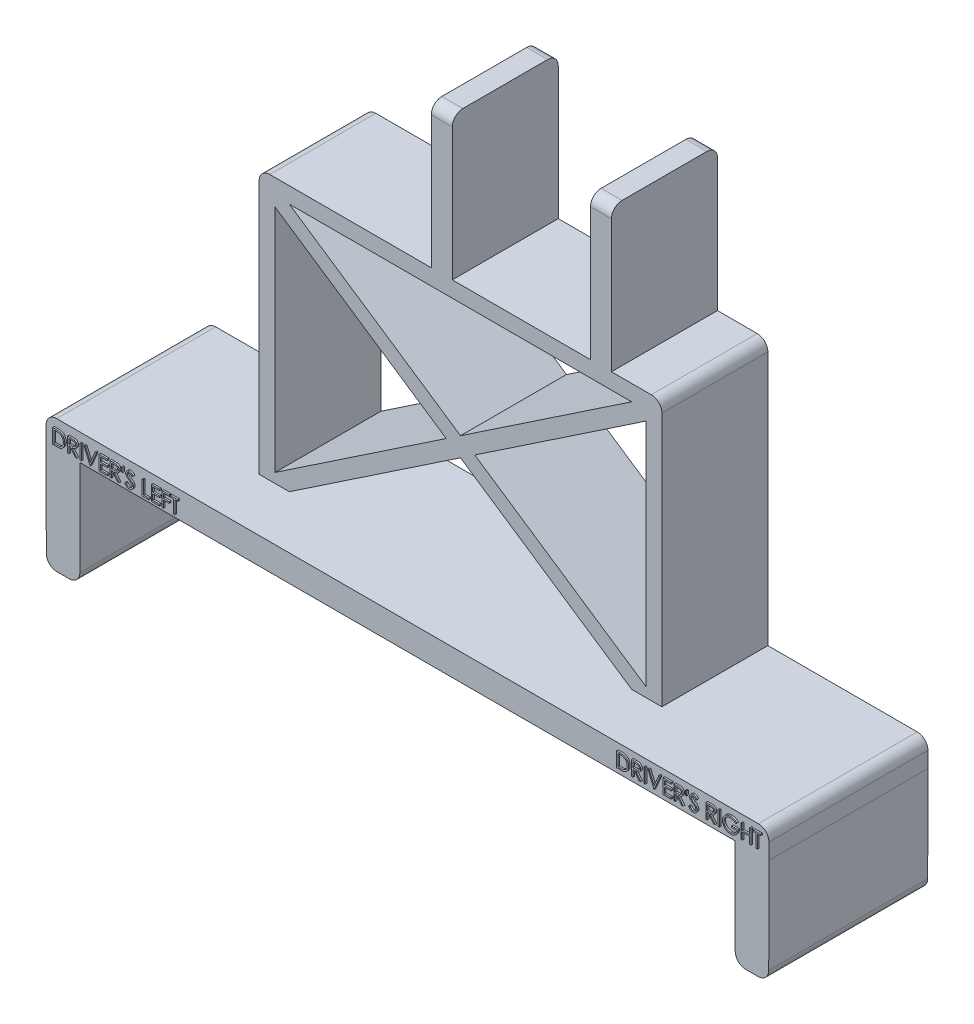
from build123d import *

# Parameters (mm, degrees)
BOSS_EXTRUDE2_DEPTH  = 38.1
BOSS_EXTRUDE6_DEPTH  = 25.4
SKETCH6_W            = 5.08
SKETCH6_H            = 25.4
BOSS_EXTRUDE5_DEPTH  = 34.29
FILLET1_R            = 2.54
BOSS_EXTRUDE7_DEPTH  = 25.4
CLEARANCE_START      = -38.1
SKETCH3_W            = 0.0508
SKETCH3_H            = 34.29
CLEARANCE_TRIM_DEPTH = 38.1
FILLET2_R            = 2.54
SKETCH12_W           = 0.314102565
SKETCH12_H           = 3.5
SKETCH12_W_2         = 0.314102564
TEXT_2_DEPTH         = 0.4


with BuildPart() as part:
    # Sketch1 → Boss-Extrude2 (new body)
    with BuildSketch(Plane.XY):
        Polygon((8.128, 0), (8.128, 25.4), (165.1, 25.4), (165.1, 0), (173.228, 0), (173.228, 31.75), (0, 31.75), (0, 0), align=None)
    extrude(amount=BOSS_EXTRUDE2_DEPTH)

    # Sketch7 → Boss-Extrude6 (add)
    with BuildSketch(Plane.XY):
        Polygon((38.354, 95.25), (38.354, 31.75), (42.164, 31.75), (42.164, 91.44), (131.064, 91.44), (131.064, 31.75), (134.874, 31.75), (134.874, 95.25), align=None)
    extrude(amount=BOSS_EXTRUDE6_DEPTH)

    # Sketch6 → Boss-Extrude5 (add)
    with BuildSketch(Plane(origin=(0, 95.25, 0), x_dir=(1, 0, 0), z_dir=(0, 1, 0))):
        with Locations((82.15122, -12.7)):
            Rectangle(SKETCH6_W, SKETCH6_H)
        with Locations((120.25122, -12.7)):
            Rectangle(SKETCH6_W, SKETCH6_H)
    extrude(amount=BOSS_EXTRUDE5_DEPTH)

    # Fillet1
    fillet1_edges = [part.edges().sort_by_distance(p)[0] for p in [
        (0, 31.75, 19.05),
        (173.228, 31.75, 19.05),
        (134.874, 95.25, 12.7),
        (38.354, 95.25, 12.7),
        (82.15122, 129.54, 0),
        (82.15122, 129.54, 25.4),
        (120.25122, 129.54, 0),
        (120.25122, 129.54, 25.4),
    ]]
    fillet(fillet1_edges, radius=FILLET1_R)

    # Sketch11 → Boss-Extrude7 (add)
    with BuildSketch(Plane.XY):
        Polygon((42.164, 89.145430603), (83.196556217, 61.595), (42.164, 34.044569397), (42.164, 31.75), (45.581443783, 31.75), (86.614, 59.300430603), (127.646556217, 31.75), (131.064, 31.75), (131.064, 34.044569397), (90.031443783, 61.595), (131.064, 89.145430603), (131.064, 91.44), (127.646556217, 91.44), (86.614, 63.889569397), (45.581443783, 91.44), (42.164, 91.44), align=None)
    extrude(amount=BOSS_EXTRUDE7_DEPTH)

    # Sketch3 → Clearance Trim (cut)
    with BuildSketch(Plane.XY.offset(38.1).offset(CLEARANCE_START)):
        with Locations((84.66582, 112.395)):
            Rectangle(SKETCH3_W, SKETCH3_H)
        with Locations((117.73662, 112.395)):
            Rectangle(SKETCH3_W, SKETCH3_H)
        Polygon((0, 25.4), (0.0508, 0), (0, 0), align=None)
        Polygon((8.128, 25.4), (8.0772, 0), (8.128, 0), align=None)
        Polygon((165.1, 0), (165.1, 25.4), (165.1508, 0), align=None)
        Polygon((173.228, 25.4), (173.1772, 0), (173.228, 0), align=None)
    extrude(amount=CLEARANCE_TRIM_DEPTH, mode=Mode.SUBTRACT)

    # Fillet2
    fillet2_edges = [part.edges().sort_by_distance(p)[0] for p in [
        (0.0508, 0, 19.05),
        (165.1508, 0, 19.05),
        (8.0772, 0, 19.05),
        (173.1772, 0, 19.05),
    ]]
    fillet(fillet2_edges, radius=FILLET2_R)

    # Sketch12 → Text 2 (add)
    # profile 1 of 25: a face of its own
    with BuildSketch(Plane.XY.offset(38.1)):
        with BuildLine():
            Line((137.105766894, 26.785075079), (137.105766894, 30.285075079))
            Line((137.105766894, 30.285075079), (137.812497663, 30.285075079))
            add(Edge.make_bspline(
                [(137.812497663, 30.285075079), (137.873966652, 30.284632509), (137.992724417, 30.283777466), (138.164336864, 30.278356075), (138.323120627, 30.268765609), (138.468553486, 30.254796083), (138.601034698, 30.23764305), (138.720193306, 30.216142645), (138.826645449, 30.190754475), (138.892114889, 30.169109025), (138.923074586, 30.158873156)],
                knots=[0, 0, 0, 0, 1.314313732, 2.53924729, 3.670748893, 4.714932338, 5.66265055, 6.526160246, 7.303039223, 8, 8, 8, 8], degree=3))
            add(Edge.make_bspline(
                [(138.923074586, 30.158873156), (138.963569326, 30.143442451), (139.043640518, 30.112930957), (139.157647641, 30.055374655), (139.264973004, 29.990161553), (139.366192148, 29.917205691), (139.458992975, 29.834441342), (139.547000872, 29.745384257), (139.626615595, 29.646795916), (139.699523891, 29.540720928), (139.765259551, 29.428408876), (139.822398709, 29.310073768), (139.869852702, 29.18631656), (139.909245929, 29.057481412), (139.940292386, 28.923285034), (139.961474318, 28.783571168), (139.975445308, 28.638891978), (139.976849359, 28.540717515), (139.977561766, 28.490904406)],
                knots=[0, 0, 0, 0, 0.984719456, 1.947108742, 2.898477687, 3.838006223, 4.779231079, 5.722358779, 6.681677486, 7.655904652, 8.64651281, 9.637519902, 10.640069247, 11.656948941, 12.698408672, 13.768548281, 14.867775369, 16, 16, 16, 16], degree=3))
            add(Edge.make_bspline(
                [(139.977561766, 28.490904406), (139.976932798, 28.447643168), (139.975693352, 28.362392379), (139.964564036, 28.236751483), (139.948387716, 28.114837912), (139.923343519, 27.997232212), (139.892941005, 27.882903994), (139.853976854, 27.77307175), (139.809341358, 27.66672794), (139.757291479, 27.565310464), (139.700150094, 27.469227092), (139.638828351, 27.378651564), (139.573391656, 27.294876342), (139.503216023, 27.21764773), (139.429208306, 27.147082152), (139.350883976, 27.082590136), (139.268040925, 27.025433581), (139.181050202, 26.973366473), (139.087374073, 26.927946118), (138.985238207, 26.889516108), (138.874207029, 26.857669493), (138.754553072, 26.831098597), (138.626069594, 26.810021294), (138.488630628, 26.795894902), (138.342447339, 26.786341969), (138.242068073, 26.785505576), (138.190402311, 26.785075079)],
                knots=[0, 0, 0, 0, 1.105936401, 2.179363191, 3.223086493, 4.248585256, 5.251745608, 6.245858792, 7.225916811, 8.198733463, 9.158002045, 10.082870192, 10.993790845, 11.873723703, 12.748670949, 13.606408763, 14.465103618, 15.319838547, 16.196477973, 17.123216899, 18.106603292, 19.147568657, 20.255746949, 21.433717677, 22.679120308, 24, 24, 24, 24], degree=3))
            Line((138.190402311, 26.785075079), (137.105766894, 26.785075079))
        make_face()
        with BuildLine():
            Line((137.419869458, 27.144049438), (137.821612247, 27.144049438))
            add(Edge.make_bspline(
                [(137.821612247, 27.144049438), (137.879340617, 27.144297535), (137.990373416, 27.144774715), (138.150031413, 27.148961918), (138.29591081, 27.155803856), (138.428032319, 27.165378933), (138.546321343, 27.178047549), (138.651025093, 27.192172451), (138.741800352, 27.209769902), (138.796729788, 27.225720861), (138.822113048, 27.233091906)],
                knots=[0, 0, 0, 0, 1.375205317, 2.645023457, 3.804390687, 4.853969522, 5.800190428, 6.637939096, 7.370582563, 8, 8, 8, 8], degree=3))
            add(Edge.make_bspline(
                [(138.822113048, 27.233091906), (138.85406141, 27.244343465), (138.917195048, 27.266577838), (139.008076133, 27.307135499), (139.092833138, 27.355177569), (139.172943163, 27.408579843), (139.247269819, 27.469225845), (139.316693935, 27.535796834), (139.381075737, 27.608631609), (139.439750044, 27.68763977), (139.492258349, 27.772329566), (139.537729578, 27.861868399), (139.57758111, 27.95527521), (139.608859702, 28.053984368), (139.633375286, 28.157113427), (139.650739974, 28.26466964), (139.661554699, 28.376632922), (139.662816147, 28.452785046), (139.663459202, 28.491605528)],
                knots=[0, 0, 0, 0, 0.998632004, 1.973411704, 2.929992603, 3.868527914, 4.809262121, 5.754881198, 6.702106254, 7.672490631, 8.653608572, 9.636854334, 10.631411391, 11.644891563, 12.686317036, 13.754757253, 14.855430412, 16, 16, 16, 16], degree=3))
            add(Edge.make_bspline(
                [(139.663459202, 28.491605528), (139.662945914, 28.532539008), (139.661937557, 28.612953193), (139.649263246, 28.730943888), (139.630741691, 28.844424539), (139.603958005, 28.953402734), (139.569827126, 29.058091086), (139.527232484, 29.157910596), (139.478565865, 29.253915465), (139.420662528, 29.343889831), (139.357246935, 29.42898294), (139.286869056, 29.506937856), (139.210647017, 29.577932156), (139.129412168, 29.643071469), (139.040875068, 29.699735144), (138.947121378, 29.750421826), (138.846775706, 29.793437717), (138.77696301, 29.81631658), (138.741484042, 29.827943669)],
                knots=[0, 0, 0, 0, 1.122418816, 2.205001699, 3.251619955, 4.274784885, 5.280384055, 6.268708349, 7.249350384, 8.229342522, 9.199999885, 10.157847722, 11.105861043, 12.055065948, 13.010012805, 13.98527497, 14.976112212, 16, 16, 16, 16], degree=3))
            add(Edge.make_bspline(
                [(138.741484042, 29.827943669), (138.712132895, 29.836060097), (138.649724305, 29.85331785), (138.547884841, 29.872143222), (138.433269691, 29.888747721), (138.30536999, 29.90280576), (138.164331531, 29.912893082), (138.010045843, 29.920464396), (137.842446239, 29.925571029), (137.726263705, 29.925919736), (137.665963208, 29.92610072)],
                knots=[0, 0, 0, 0, 0.674548936, 1.434276114, 2.292660221, 3.240891867, 4.284742987, 5.42552168, 6.663806718, 8, 8, 8, 8], degree=3))
            Line((137.665963208, 29.92610072), (137.419869458, 29.92610072))
            Line((137.419869458, 29.92610072), (137.419869458, 27.144049438))
        make_face(mode=Mode.SUBTRACT)
    # profile 2 of 25: a face of its own
    with BuildSketch(Plane.XY.offset(38.1)):
        with BuildLine():
            Line((140.695510484, 30.285075079), (141.395931157, 30.285075079))
            add(Edge.make_bspline(
                [(141.395931157, 30.285075079), (141.442672285, 30.284919493), (141.53242043, 30.284620751), (141.6609937, 30.282954988), (141.777820797, 30.278180632), (141.882840637, 30.274072049), (141.976051292, 30.266580108), (142.057738582, 30.259419461), (142.12752628, 30.2500458), (142.169772131, 30.241340377), (142.188899907, 30.237398797)],
                knots=[0, 0, 0, 0, 1.410062039, 2.707475311, 3.878576406, 4.937260626, 5.877586885, 6.699081471, 7.410979367, 8, 8, 8, 8], degree=3))
            add(Edge.make_bspline(
                [(142.188899907, 30.237398797), (142.214506531, 30.231072032), (142.265173521, 30.218553468), (142.338123587, 30.192093867), (142.407637911, 30.161474243), (142.473427735, 30.125510523), (142.535163526, 30.083935743), (142.593481837, 30.03746762), (142.6486473, 29.986360415), (142.69842893, 29.929325573), (142.745367982, 29.869489063), (142.784956609, 29.804785307), (142.819083088, 29.737123779), (142.846253605, 29.665816361), (142.868131579, 29.591554589), (142.883557818, 29.513665793), (142.892809006, 29.432504818), (142.893750861, 29.377146909), (142.894228433, 29.349077483)],
                knots=[0, 0, 0, 0, 1.027469482, 2.033020251, 3.019912614, 3.986113645, 4.951240523, 5.91722682, 6.890402269, 7.87763091, 8.8651537, 9.85103654, 10.82876324, 11.815024772, 12.821070561, 13.842952187, 14.906261191, 16, 16, 16, 16], degree=3))
            add(Edge.make_bspline(
                [(142.894228433, 29.349077483), (142.892759435, 29.302442379), (142.889893039, 29.211445211), (142.863167935, 29.079384329), (142.819391415, 28.956195015), (142.759068126, 28.842032377), (142.682248651, 28.739121731), (142.589923859, 28.648731276), (142.482042248, 28.573091363), (142.381612932, 28.520638559), (142.292898732, 28.48704565), (142.21986542, 28.463409291), (142.140198442, 28.445147326), (142.054661107, 28.428787194), (141.962897452, 28.4164355), (141.865127413, 28.407388905), (141.761281261, 28.401734857), (141.689942192, 28.400892852), (141.653242856, 28.400459695)],
                knots=[0, 0, 0, 0, 1.260483769, 2.459530307, 3.627416485, 4.787058657, 5.939039949, 7.08810263, 8.267026773, 9.491475466, 10.141966685, 10.831826277, 11.566392101, 12.351337768, 13.187381173, 14.07005841, 15.007169909, 16, 16, 16, 16], degree=3))
            Line((141.653242856, 28.400459695), (142.939100227, 26.785075079))
            Line((142.939100227, 26.785075079), (142.550678753, 26.785075079))
            Line((142.550678753, 26.785075079), (141.264821381, 28.400459695))
            Line((141.264821381, 28.400459695), (141.009613048, 28.400459695))
            Line((141.009613048, 28.400459695), (141.009613048, 26.785075079))
            Line((141.009613048, 26.785075079), (140.695510484, 26.785075079))
            Line((140.695510484, 26.785075079), (140.695510484, 30.285075079))
        make_face()
        with BuildLine():
            Line((141.009613048, 29.92610072), (141.009613048, 28.759434054))
            Line((141.009613048, 28.759434054), (141.650438369, 28.754526201))
            add(Edge.make_bspline(
                [(141.650438369, 28.754526201), (141.680358407, 28.754512964), (141.738351965, 28.754487308), (141.822252629, 28.758481084), (141.900372741, 28.763024403), (141.972413493, 28.769973748), (142.038407069, 28.77892982), (142.098320482, 28.790132804), (142.152251534, 28.803184867), (142.215150072, 28.823386493), (142.285386603, 28.855392511), (142.361718063, 28.901958009), (142.426720401, 28.960527129), (142.481638263, 29.027500585), (142.525767695, 29.101136834), (142.556879749, 29.180553203), (142.576622191, 29.263744801), (142.578950737, 29.320922909), (142.580125869, 29.349778605)],
                knots=[0, 0, 0, 0, 1.146690395, 2.22261258, 3.21895312, 4.145990853, 4.996080663, 5.770904154, 6.481378293, 7.121626537, 8.300444488, 9.431385265, 10.535395872, 11.636531494, 12.74115979, 13.810798291, 14.895190096, 16, 16, 16, 16], degree=3))
            add(Edge.make_bspline(
                [(142.580125869, 29.349778605), (142.578923747, 29.377925179), (142.576541582, 29.433701417), (142.557092814, 29.515357328), (142.524203432, 29.592424278), (142.479881194, 29.664588763), (142.425882039, 29.730094499), (142.362564227, 29.786141652), (142.291659031, 29.832391116), (142.225387833, 29.861945497), (142.166153621, 29.88006535), (142.114723961, 29.892816514), (142.056612483, 29.903060983), (141.991537024, 29.911269044), (141.919775393, 29.918323988), (141.840964742, 29.923075767), (141.755627962, 29.925889631), (141.696481031, 29.92602872), (141.665863048, 29.92610072)],
                knots=[0, 0, 0, 0, 1.101028733, 2.181837193, 3.264309656, 4.369019818, 5.486613113, 6.575447106, 7.666700264, 8.788928104, 9.402425223, 10.0903467, 10.862060571, 11.710948788, 12.657782767, 13.684531032, 14.801375019, 16, 16, 16, 16], degree=3))
            Line((141.665863048, 29.92610072), (141.009613048, 29.92610072))
        make_face(mode=Mode.SUBTRACT)
    # profile 3 of 25: a face of its own
    with BuildSketch(Plane.XY.offset(38.1)):
        with Locations((143.814100228, 28.535075079)):
            Rectangle(SKETCH12_W, SKETCH12_H)
    # profile 4 of 25: a face of its own
    with BuildSketch(Plane.XY.offset(38.1)):
        Polygon((144.599356638, 30.285075079), (144.935895099, 30.285075079), (146.102561766, 27.526861938), (147.269228433, 30.285075079), (147.605766894, 30.285075079), (146.124997663, 26.785075079), (146.080125869, 26.785075079), align=None)
    # profile 5 of 25: a face of its own
    with BuildSketch(Plane.XY.offset(38.1)):
        Polygon((148.233972022, 30.285075079), (150.208330997, 30.285075079), (150.208330997, 29.92610072), (148.548074586, 29.92610072), (148.548074586, 28.849177643), (150.208330997, 28.849177643), (150.208330997, 28.490203284), (148.548074586, 28.490203284), (148.548074586, 27.144049438), (150.208330997, 27.144049438), (150.208330997, 26.785075079), (148.233972022, 26.785075079), align=None)
    # profile 6 of 25: a face of its own
    with BuildSketch(Plane.XY.offset(38.1)):
        with BuildLine():
            Line((150.836536125, 30.285075079), (151.536956798, 30.285075079))
            add(Edge.make_bspline(
                [(151.536956798, 30.285075079), (151.583697927, 30.284919493), (151.673446071, 30.284620751), (151.802019341, 30.282954988), (151.918846438, 30.278180632), (152.023866278, 30.274072049), (152.117076933, 30.266580108), (152.198764223, 30.259419461), (152.268551921, 30.2500458), (152.310797772, 30.241340377), (152.329925548, 30.237398797)],
                knots=[0, 0, 0, 0, 1.410062039, 2.707475311, 3.878576406, 4.937260626, 5.877586885, 6.699081471, 7.410979367, 8, 8, 8, 8], degree=3))
            add(Edge.make_bspline(
                [(152.329925548, 30.237398797), (152.355532172, 30.231072032), (152.406199162, 30.218553468), (152.479149228, 30.192093867), (152.548663552, 30.161474243), (152.614453376, 30.125510523), (152.676189167, 30.083935743), (152.734507478, 30.03746762), (152.789672941, 29.986360415), (152.839454571, 29.929325573), (152.886393623, 29.869489063), (152.92598225, 29.804785307), (152.960108729, 29.737123779), (152.987279246, 29.665816361), (153.00915722, 29.591554589), (153.024583459, 29.513665793), (153.033834647, 29.432504818), (153.034776502, 29.377146909), (153.035254074, 29.349077483)],
                knots=[0, 0, 0, 0, 1.027469482, 2.033020251, 3.019912614, 3.986113645, 4.951240523, 5.91722682, 6.890402269, 7.87763091, 8.8651537, 9.85103654, 10.82876324, 11.815024772, 12.821070561, 13.842952187, 14.906261191, 16, 16, 16, 16], degree=3))
            add(Edge.make_bspline(
                [(153.035254074, 29.349077483), (153.033785076, 29.302442379), (153.03091868, 29.211445211), (153.004193576, 29.079384329), (152.960417056, 28.956195015), (152.900093767, 28.842032377), (152.823274292, 28.739121731), (152.730949501, 28.648731276), (152.623067889, 28.573091363), (152.522638573, 28.520638559), (152.433924373, 28.48704565), (152.360891061, 28.463409291), (152.281224083, 28.445147326), (152.195686748, 28.428787194), (152.103923093, 28.4164355), (152.006153054, 28.407388905), (151.902306902, 28.401734857), (151.830967833, 28.400892852), (151.794268497, 28.400459695)],
                knots=[0, 0, 0, 0, 1.260483769, 2.459530307, 3.627416485, 4.787058657, 5.939039949, 7.08810263, 8.267026773, 9.491475466, 10.141966685, 10.831826277, 11.566392101, 12.351337768, 13.187381173, 14.07005841, 15.007169909, 16, 16, 16, 16], degree=3))
            Line((151.794268497, 28.400459695), (153.080125869, 26.785075079))
            Line((153.080125869, 26.785075079), (152.691704394, 26.785075079))
            Line((152.691704394, 26.785075079), (151.405847022, 28.400459695))
            Line((151.405847022, 28.400459695), (151.150638689, 28.400459695))
            Line((151.150638689, 28.400459695), (151.150638689, 26.785075079))
            Line((151.150638689, 26.785075079), (150.836536125, 26.785075079))
            Line((150.836536125, 26.785075079), (150.836536125, 30.285075079))
        make_face()
        with BuildLine():
            Line((151.150638689, 29.92610072), (151.150638689, 28.759434054))
            Line((151.150638689, 28.759434054), (151.79146401, 28.754526201))
            add(Edge.make_bspline(
                [(151.79146401, 28.754526201), (151.821384048, 28.754512964), (151.879377606, 28.754487308), (151.96327827, 28.758481084), (152.041398382, 28.763024403), (152.113439134, 28.769973748), (152.17943271, 28.77892982), (152.239346123, 28.790132804), (152.293277175, 28.803184867), (152.356175713, 28.823386493), (152.426412244, 28.855392511), (152.502743704, 28.901958009), (152.567746042, 28.960527129), (152.622663904, 29.027500585), (152.666793336, 29.101136834), (152.69790539, 29.180553203), (152.717647833, 29.263744801), (152.719976378, 29.320922909), (152.72115151, 29.349778605)],
                knots=[0, 0, 0, 0, 1.146690395, 2.22261258, 3.21895312, 4.145990853, 4.996080663, 5.770904154, 6.481378293, 7.121626537, 8.300444488, 9.431385265, 10.535395872, 11.636531494, 12.74115979, 13.810798291, 14.895190096, 16, 16, 16, 16], degree=3))
            add(Edge.make_bspline(
                [(152.72115151, 29.349778605), (152.719949388, 29.377925179), (152.717567223, 29.433701417), (152.698118455, 29.515357328), (152.665229073, 29.592424278), (152.620906835, 29.664588763), (152.56690768, 29.730094499), (152.503589868, 29.786141652), (152.432684672, 29.832391116), (152.366413474, 29.861945497), (152.307179262, 29.88006535), (152.255749602, 29.892816514), (152.197638124, 29.903060983), (152.132562665, 29.911269044), (152.060801034, 29.918323988), (151.981990383, 29.923075767), (151.896653603, 29.925889631), (151.837506672, 29.92602872), (151.806888689, 29.92610072)],
                knots=[0, 0, 0, 0, 1.101028733, 2.181837193, 3.264309656, 4.369019818, 5.486613113, 6.575447106, 7.666700264, 8.788928104, 9.402425223, 10.0903467, 10.862060571, 11.710948788, 12.657782767, 13.684531032, 14.801375019, 16, 16, 16, 16], degree=3))
            Line((151.806888689, 29.92610072), (151.150638689, 29.92610072))
        make_face(mode=Mode.SUBTRACT)
    # profile 7 of 25: a face of its own
    with BuildSketch(Plane.XY.offset(38.1)):
        Polygon((153.883611445, 29.297895592), (153.665562567, 29.297895592), (153.618587407, 30.374818669), (153.932689971, 30.374818669), align=None)
    # profile 8 of 25: a face of its own
    with BuildSketch(Plane.XY.offset(38.1)):
        with BuildLine():
            Line((154.38140792, 27.460255368), (154.677281317, 27.637639182))
            add(Edge.make_bspline(
                [(154.677281317, 27.637639182), (154.704799554, 27.591574797), (154.757523435, 27.503317213), (154.845474794, 27.384059173), (154.936607705, 27.282697016), (155.031597039, 27.199820408), (155.129862987, 27.134571522), (155.232047041, 27.08836929), (155.337804852, 27.059553315), (155.409778673, 27.056053228), (155.445710804, 27.054305849)],
                knots=[0, 0, 0, 0, 1.272034388, 2.437168799, 3.508375237, 4.49857839, 5.41946034, 6.295179144, 7.148887113, 8, 8, 8, 8], degree=3))
            add(Edge.make_bspline(
                [(155.445710804, 27.054305849), (155.476397665, 27.055160521), (155.537234438, 27.056854911), (155.626796681, 27.073135713), (155.713778483, 27.098147842), (155.796387121, 27.133968774), (155.873482735, 27.17730726), (155.941089431, 27.229653437), (155.999535544, 27.288259643), (156.047344659, 27.353642297), (156.084024694, 27.423959446), (156.112216762, 27.496135397), (156.127861836, 27.571303966), (156.130218589, 27.621914428), (156.13140792, 27.647454887)],
                knots=[0, 0, 0, 0, 1.095163259, 2.171163733, 3.241058638, 4.321873601, 5.38011039, 6.391990106, 7.366004449, 8.327778327, 9.272591725, 10.192022065, 11.087607919, 12, 12, 12, 12], degree=3))
            add(Edge.make_bspline(
                [(156.13140792, 27.647454887), (156.129933609, 27.676595737), (156.126936551, 27.735834826), (156.101605071, 27.823234479), (156.061755824, 27.909727049), (156.02499318, 27.963228314), (156.005907119, 27.991004567)],
                knots=[0, 0, 0, 0, 0.938893495, 1.908633276, 2.914225137, 4, 4, 4, 4], degree=3))
            add(Edge.make_bspline(
                [(156.005907119, 27.991004567), (155.990236504, 28.01105139), (155.95733801, 28.053137189), (155.900780497, 28.115782424), (155.834414383, 28.180400843), (155.760510828, 28.2494599), (155.676377739, 28.319747697), (155.584650225, 28.394615975), (155.482986366, 28.471217552), (155.411686869, 28.522590117), (155.374897503, 28.549097515)],
                knots=[0, 0, 0, 0, 0.722233717, 1.516239348, 2.393582979, 3.351407094, 4.387010283, 5.505090956, 6.712668013, 8, 8, 8, 8], degree=3))
            add(Edge.make_bspline(
                [(155.374897503, 28.549097515), (155.338073507, 28.575326103), (155.26766883, 28.625473165), (155.169210248, 28.699897449), (155.081165785, 28.767941319), (155.003926768, 28.830245331), (154.937527172, 28.886817936), (154.881443761, 28.937115875), (154.837105204, 28.982499436), (154.812449623, 29.011940777), (154.801379875, 29.025159214)],
                knots=[0, 0, 0, 0, 1.452282411, 2.77665338, 3.964542531, 5.026858415, 5.96415736, 6.766646006, 7.446254459, 8, 8, 8, 8], degree=3))
            add(Edge.make_bspline(
                [(154.801379875, 29.025159214), (154.78590733, 29.045760251), (154.755478493, 29.086274955), (154.715312488, 29.149599812), (154.681173325, 29.214423078), (154.654410993, 29.280918942), (154.631874774, 29.348153871), (154.616716843, 29.417005117), (154.607225446, 29.487163735), (154.60625346, 29.534377236), (154.605766894, 29.558011778)],
                knots=[0, 0, 0, 0, 1.068054152, 2.10047183, 3.106115577, 4.101338837, 5.06977816, 6.043150881, 7.020423561, 8, 8, 8, 8], degree=3))
            add(Edge.make_bspline(
                [(154.605766894, 29.558011778), (154.607072103, 29.595041553), (154.609654623, 29.668309616), (154.63149514, 29.775340447), (154.665968034, 29.877526864), (154.714262922, 29.973857198), (154.776520275, 30.061823179), (154.848566249, 30.142436666), (154.934377736, 30.210205248), (155.028530359, 30.269417306), (155.131586731, 30.315763231), (155.239577634, 30.350724212), (155.352674706, 30.370533469), (155.429277841, 30.373376234), (155.468146702, 30.374818669)],
                knots=[0, 0, 0, 0, 1.005424448, 1.989358655, 2.955360095, 3.929531133, 4.905563448, 5.876582895, 6.856512386, 7.866279853, 8.892233794, 9.918561126, 10.94386622, 12, 12, 12, 12], degree=3))
            add(Edge.make_bspline(
                [(155.468146702, 30.374818669), (155.509390802, 30.373396118), (155.591412154, 30.370567116), (155.712061369, 30.345969585), (155.828222086, 30.305268913), (155.921665351, 30.259080255), (155.994798112, 30.21294884), (156.050570845, 30.170929015), (156.107088296, 30.122553907), (156.16480635, 30.067694661), (156.22274701, 30.00584791), (156.281770462, 29.937437221), (156.342014731, 29.862880665), (156.380770591, 29.809656164), (156.400638689, 29.782370752)],
                knots=[0, 0, 0, 0, 1.286793592, 2.559021753, 3.825965368, 5.121522368, 5.803751409, 6.523245864, 7.299691795, 8.125521123, 9.008227632, 9.944561021, 10.946284179, 12, 12, 12, 12], degree=3))
            Line((156.400638689, 29.782370752), (156.116684362, 29.567126361))
            add(Edge.make_bspline(
                [(156.116684362, 29.567126361), (156.09953843, 29.589215052), (156.066519373, 29.631752705), (156.016389886, 29.691324021), (155.969141238, 29.7457405), (155.922590838, 29.793005628), (155.879197207, 29.835707762), (155.837080164, 29.872267518), (155.796845813, 29.903043114), (155.746128902, 29.935886674), (155.682411184, 29.968443177), (155.602426648, 29.995992255), (155.518840373, 30.012547317), (155.461910741, 30.014736205), (155.433090612, 30.01584431)],
                knots=[0, 0, 0, 0, 1.181633172, 2.275549214, 3.290209073, 4.226197932, 5.078386478, 5.862611352, 6.581680152, 7.217281963, 8.414376989, 9.595101626, 10.782541182, 12, 12, 12, 12], degree=3))
            add(Edge.make_bspline(
                [(155.433090612, 30.01584431), (155.39693409, 30.01463261), (155.327209642, 30.012295961), (155.228219406, 29.986775976), (155.139125481, 29.946594115), (155.062572916, 29.890279137), (154.998835939, 29.823558145), (154.95273048, 29.74677929), (154.924980316, 29.661996887), (154.921594036, 29.602855231), (154.919869458, 29.572735336)],
                knots=[0, 0, 0, 0, 1.14458467, 2.207223713, 3.21896685, 4.227309161, 5.202851033, 6.127160689, 7.046193047, 8, 8, 8, 8], degree=3))
            add(Edge.make_bspline(
                [(154.919869458, 29.572735336), (154.920262585, 29.553983857), (154.921049481, 29.516450238), (154.932024279, 29.460998816), (154.946123608, 29.405687476), (154.968466239, 29.350764894), (154.999311543, 29.295270535), (155.039816719, 29.238248797), (155.090830031, 29.179197088), (155.129907043, 29.140789715), (155.150538529, 29.120511778)],
                knots=[0, 0, 0, 0, 0.858281714, 1.717966888, 2.583508476, 3.4729293, 4.427298488, 5.488583878, 6.674047936, 8, 8, 8, 8], degree=3))
            add(Edge.make_bspline(
                [(155.150538529, 29.120511778), (155.158199901, 29.113674752), (155.176401568, 29.097431544), (155.209677494, 29.070839263), (155.253620292, 29.038036491), (155.307082493, 28.997449175), (155.371049855, 28.950367712), (155.445529411, 28.8973941), (155.529690944, 28.836808641), (155.58941286, 28.794451101), (155.620991253, 28.772054246)],
                knots=[0, 0, 0, 0, 0.420754252, 0.999615792, 1.744751191, 2.668019286, 3.750313428, 4.999500688, 6.413464383, 8, 8, 8, 8], degree=3))
            add(Edge.make_bspline(
                [(155.620991253, 28.772054246), (155.658977166, 28.744412886), (155.732531623, 28.690889225), (155.837189203, 28.610473545), (155.932083011, 28.531825776), (156.017546214, 28.455448169), (156.094423123, 28.381920076), (156.161860844, 28.310356896), (156.220546524, 28.241271323), (156.283725742, 28.152698747), (156.348283562, 28.043917663), (156.403725069, 27.910639424), (156.438683417, 27.776843104), (156.443254932, 27.686916268), (156.445510484, 27.642547034)],
                knots=[0, 0, 0, 0, 1.163667725, 2.253281268, 3.268753668, 4.215851969, 5.092017293, 5.902905408, 6.650798638, 7.335211899, 8.59617414, 9.77448103, 10.901945474, 12, 12, 12, 12], degree=3))
            add(Edge.make_bspline(
                [(156.445510484, 27.642547034), (156.444853346, 27.611168669), (156.443551831, 27.549021286), (156.428590917, 27.457766209), (156.406671252, 27.369135339), (156.373634018, 27.284224227), (156.33331086, 27.201479464), (156.282144612, 27.123071564), (156.222836927, 27.047265165), (156.154803162, 26.976081674), (156.08035726, 26.910735478), (156.001673565, 26.852606416), (155.918623292, 26.804138093), (155.831656975, 26.764587251), (155.740754639, 26.733653733), (155.645946855, 26.711240864), (155.547077344, 26.697485153), (155.479876862, 26.696057392), (155.445710804, 26.69533149)],
                knots=[0, 0, 0, 0, 0.983748083, 1.948392443, 2.894712957, 3.844097841, 4.80183111, 5.778335162, 6.776009319, 7.81870978, 8.863265674, 9.881300176, 10.883814829, 11.87499822, 12.874611388, 13.892143829, 14.928324115, 16, 16, 16, 16], degree=3))
            add(Edge.make_bspline(
                [(155.445710804, 26.69533149), (155.419275461, 26.695842671), (155.366737701, 26.696858597), (155.289028219, 26.705839877), (155.21288863, 26.718546981), (155.139274348, 26.738721051), (155.067236937, 26.763198028), (154.997089702, 26.79333636), (154.928798648, 26.829453562), (154.861981065, 26.870748586), (154.796806891, 26.918806331), (154.733887423, 26.974779827), (154.671158237, 27.037125332), (154.610470841, 27.107535896), (154.550597697, 27.184873979), (154.492719287, 27.269863162), (154.43563757, 27.362040516), (154.399822102, 27.426905601), (154.38140792, 27.460255368)],
                knots=[0, 0, 0, 0, 0.915332311, 1.819136955, 2.706846663, 3.586547465, 4.459518054, 5.340707479, 6.227863349, 7.133153174, 8.059268498, 9.028702269, 10.047606654, 11.120612155, 12.245963614, 13.433783089, 14.680604001, 16, 16, 16, 16], degree=3))
        make_face()
    # profile 9 of 25: a face of its own
    with BuildSketch(Plane.XY.offset(38.1)):
        with BuildLine():
            Line((158.509613048, 30.285075079), (159.210033721, 30.285075079))
            add(Edge.make_bspline(
                [(159.210033721, 30.285075079), (159.25677485, 30.284919493), (159.346522994, 30.284620751), (159.475096264, 30.282954988), (159.591923361, 30.278180632), (159.696943201, 30.274072049), (159.790153856, 30.266580108), (159.871841146, 30.259419461), (159.941628844, 30.2500458), (159.983874695, 30.241340377), (160.003002471, 30.237398797)],
                knots=[0, 0, 0, 0, 1.410062039, 2.707475311, 3.878576406, 4.937260626, 5.877586885, 6.699081471, 7.410979367, 8, 8, 8, 8], degree=3))
            add(Edge.make_bspline(
                [(160.003002471, 30.237398797), (160.028609095, 30.231072032), (160.079276085, 30.218553468), (160.152226151, 30.192093867), (160.221740475, 30.161474243), (160.287530299, 30.125510523), (160.34926609, 30.083935743), (160.407584401, 30.03746762), (160.462749864, 29.986360415), (160.512531495, 29.929325573), (160.559470546, 29.869489063), (160.599059173, 29.804785307), (160.633185652, 29.737123779), (160.660356169, 29.665816361), (160.682234143, 29.591554589), (160.697660382, 29.513665793), (160.70691157, 29.432504818), (160.707853425, 29.377146909), (160.708330997, 29.349077483)],
                knots=[0, 0, 0, 0, 1.027469482, 2.033020251, 3.019912614, 3.986113645, 4.951240523, 5.91722682, 6.890402269, 7.87763091, 8.8651537, 9.85103654, 10.82876324, 11.815024772, 12.821070561, 13.842952187, 14.906261191, 16, 16, 16, 16], degree=3))
            add(Edge.make_bspline(
                [(160.708330997, 29.349077483), (160.706861999, 29.302442379), (160.703995603, 29.211445211), (160.677270499, 29.079384329), (160.633493979, 28.956195015), (160.57317069, 28.842032377), (160.496351215, 28.739121731), (160.404026424, 28.648731276), (160.296144812, 28.573091363), (160.195715496, 28.520638559), (160.107001296, 28.48704565), (160.033967984, 28.463409291), (159.954301006, 28.445147326), (159.868763672, 28.428787194), (159.777000016, 28.4164355), (159.679229977, 28.407388905), (159.575383825, 28.401734857), (159.504044756, 28.400892852), (159.46734542, 28.400459695)],
                knots=[0, 0, 0, 0, 1.260483769, 2.459530307, 3.627416485, 4.787058657, 5.939039949, 7.08810263, 8.267026773, 9.491475466, 10.141966685, 10.831826277, 11.566392101, 12.351337768, 13.187381173, 14.07005841, 15.007169909, 16, 16, 16, 16], degree=3))
            Line((159.46734542, 28.400459695), (160.753202792, 26.785075079))
            Line((160.753202792, 26.785075079), (160.364781317, 26.785075079))
            Line((160.364781317, 26.785075079), (159.078923945, 28.400459695))
            Line((159.078923945, 28.400459695), (158.823715612, 28.400459695))
            Line((158.823715612, 28.400459695), (158.823715612, 26.785075079))
            Line((158.823715612, 26.785075079), (158.509613048, 26.785075079))
            Line((158.509613048, 26.785075079), (158.509613048, 30.285075079))
        make_face()
        with BuildLine():
            Line((158.823715612, 29.92610072), (158.823715612, 28.759434054))
            Line((158.823715612, 28.759434054), (159.464540933, 28.754526201))
            add(Edge.make_bspline(
                [(159.464540933, 28.754526201), (159.494460972, 28.754512964), (159.552454529, 28.754487308), (159.636355193, 28.758481084), (159.714475305, 28.763024403), (159.786516057, 28.769973748), (159.852509633, 28.77892982), (159.912423046, 28.790132804), (159.966354098, 28.803184867), (160.029252636, 28.823386493), (160.099489168, 28.855392511), (160.175820627, 28.901958009), (160.240822965, 28.960527129), (160.295740827, 29.027500585), (160.339870259, 29.101136834), (160.370982313, 29.180553203), (160.390724756, 29.263744801), (160.393053301, 29.320922909), (160.394228433, 29.349778605)],
                knots=[0, 0, 0, 0, 1.146690395, 2.22261258, 3.21895312, 4.145990853, 4.996080663, 5.770904154, 6.481378293, 7.121626537, 8.300444488, 9.431385265, 10.535395872, 11.636531494, 12.74115979, 13.810798291, 14.895190096, 16, 16, 16, 16], degree=3))
            add(Edge.make_bspline(
                [(160.394228433, 29.349778605), (160.393026312, 29.377925179), (160.390644146, 29.433701417), (160.371195378, 29.515357328), (160.338305996, 29.592424278), (160.293983758, 29.664588763), (160.239984603, 29.730094499), (160.176666791, 29.786141652), (160.105761596, 29.832391116), (160.039490397, 29.861945497), (159.980256185, 29.88006535), (159.928826525, 29.892816514), (159.870715047, 29.903060983), (159.805639588, 29.911269044), (159.733877958, 29.918323988), (159.655067306, 29.923075767), (159.569730526, 29.925889631), (159.510583595, 29.92602872), (159.479965612, 29.92610072)],
                knots=[0, 0, 0, 0, 1.101028733, 2.181837193, 3.264309656, 4.369019818, 5.486613113, 6.575447106, 7.666700264, 8.788928104, 9.402425223, 10.0903467, 10.862060571, 11.710948788, 12.657782767, 13.684531032, 14.801375019, 16, 16, 16, 16], degree=3))
            Line((159.479965612, 29.92610072), (158.823715612, 29.92610072))
        make_face(mode=Mode.SUBTRACT)
    # profile 10 of 25: a face of its own
    with BuildSketch(Plane.XY.offset(38.1)):
        with Locations((161.628202792, 28.535075079)):
            Rectangle(SKETCH12_W_2, SKETCH12_H)
    # profile 11 of 25: a face of its own
    with BuildSketch(Plane.XY.offset(38.1)):
        with BuildLine():
            Line((165.958330997, 29.68771931), (165.689100227, 29.432510977))
            add(Edge.make_bspline(
                [(165.689100227, 29.432510977), (165.640381339, 29.47834184), (165.544105293, 29.568910703), (165.38714505, 29.686421698), (165.223381416, 29.787087798), (165.053668919, 29.868994034), (164.882210365, 29.934346795), (164.711281589, 29.980874935), (164.542635888, 30.010547473), (164.430468669, 30.014095842), (164.375197984, 30.01584431)],
                knots=[0, 0, 0, 0, 1.08915593, 2.152340314, 3.188132944, 4.216796309, 5.218260357, 6.173443236, 7.099959455, 8, 8, 8, 8], degree=3))
            add(Edge.make_bspline(
                [(164.375197984, 30.01584431), (164.341283284, 30.015430704), (164.273541843, 30.014604565), (164.172919899, 30.00406035), (164.073353262, 29.988895486), (163.975029888, 29.966953608), (163.877758601, 29.939144549), (163.781877709, 29.904359085), (163.687208354, 29.863803841), (163.594642273, 29.816941367), (163.50490177, 29.765461521), (163.420144934, 29.70841298), (163.339831535, 29.647624191), (163.26547111, 29.581573211), (163.196635923, 29.510858346), (163.131687551, 29.43679504), (163.072910255, 29.357359821), (163.01981909, 29.274014195), (162.972457472, 29.188222006), (162.930648818, 29.100809016), (162.89555173, 29.012065162), (162.867782275, 28.921879084), (162.844871621, 28.830948494), (162.828754014, 28.738643774), (162.819667292, 28.644866088), (162.818095512, 28.58206883), (162.817305356, 28.550499759)],
                knots=[0, 0, 0, 0, 1.02818874, 2.053710826, 3.065248034, 4.081641283, 5.106893873, 6.131558223, 7.173050175, 8.228653731, 9.27666206, 10.308777013, 11.325269123, 12.329503258, 13.32196095, 14.316845687, 15.314881793, 16.315733098, 17.311955233, 18.285320748, 19.252783886, 20.203351036, 21.145449891, 22.095197417, 23.042428769, 24, 24, 24, 24], degree=3))
            add(Edge.make_bspline(
                [(162.817305356, 28.550499759), (162.818061074, 28.518228942), (162.819570447, 28.453775428), (162.829230766, 28.357581355), (162.847159007, 28.262815953), (162.871126716, 28.16916782), (162.901107531, 28.076476572), (162.938480198, 27.985144062), (162.982745798, 27.895173671), (163.03398235, 27.807376054), (163.090168554, 27.721853031), (163.153111635, 27.641293509), (163.219972218, 27.564624732), (163.293186118, 27.493548968), (163.37040566, 27.426165072), (163.453937936, 27.36432955), (163.542140397, 27.306851326), (163.635147608, 27.254454807), (163.731950391, 27.207646271), (163.831207144, 27.166022375), (163.93323496, 27.131743038), (164.037497649, 27.103804934), (164.143870921, 27.080904637), (164.252894724, 27.066172156), (164.363767432, 27.055481325), (164.438506064, 27.054699655), (164.476159522, 27.054305849)],
                knots=[0, 0, 0, 0, 0.93586088, 1.869166235, 2.799637598, 3.729985548, 4.670839027, 5.622275134, 6.589130586, 7.576015415, 8.568469353, 9.55398029, 10.53834874, 11.515998671, 12.510579167, 13.508179873, 14.527009472, 15.561807829, 16.601455013, 17.643573243, 18.680854198, 19.719860599, 20.772568776, 21.833555941, 22.908541556, 24, 24, 24, 24], degree=3))
            add(Edge.make_bspline(
                [(164.476159522, 27.054305849), (164.52153787, 27.055254425), (164.610645627, 27.057117109), (164.74163207, 27.071617398), (164.86743514, 27.094264192), (164.987701344, 27.127430088), (165.102570364, 27.169733763), (165.212463306, 27.22072915), (165.316514964, 27.282372209), (165.415038138, 27.351946076), (165.505795323, 27.429460908), (165.587649447, 27.513105364), (165.659294937, 27.60247343), (165.721799636, 27.697038746), (165.77350829, 27.797584051), (165.815951085, 27.903616613), (165.848484377, 28.015184125), (165.861839352, 28.092275757), (165.868587407, 28.131228926)],
                knots=[0, 0, 0, 0, 1.13008108, 2.219097802, 3.278683437, 4.311054135, 5.322181354, 6.324827112, 7.324222904, 8.330512327, 9.32562643, 10.293043162, 11.24128371, 12.174520618, 13.111833804, 14.052305215, 15.015860969, 16, 16, 16, 16], degree=3))
            Line((165.868587407, 28.131228926), (164.70192074, 28.131228926))
            Line((164.70192074, 28.131228926), (164.70192074, 28.490203284))
            Line((164.70192074, 28.490203284), (166.182689971, 28.490203284))
            add(Edge.make_bspline(
                [(166.182689971, 28.490203284), (166.180984123, 28.423295796), (166.177645469, 28.292345754), (166.154226554, 28.101375483), (166.116410041, 27.92100379), (166.064749729, 27.751040718), (165.997874449, 27.591727125), (165.916501921, 27.442901259), (165.8193298, 27.305524578), (165.709819358, 27.178475575), (165.5869194, 27.065146363), (165.45395078, 26.965540425), (165.310693812, 26.881637809), (165.157284005, 26.813377147), (164.994223571, 26.760103152), (164.821135191, 26.722331575), (164.638253591, 26.699701612), (164.512916914, 26.696810233), (164.448815772, 26.69533149)],
                knots=[0, 0, 0, 0, 1.140356446, 2.231883559, 3.274166699, 4.278491846, 5.25512956, 6.21435461, 7.1637429, 8.11826594, 9.068280886, 10.0076534, 10.945064095, 11.891975133, 12.864533718, 13.863980011, 14.907571808, 16, 16, 16, 16], degree=3))
            add(Edge.make_bspline(
                [(164.448815772, 26.69533149), (164.409305637, 26.695900611), (164.331378916, 26.697023101), (164.216287988, 26.705000449), (164.104370367, 26.717281025), (163.995642359, 26.735826149), (163.889704016, 26.758540803), (163.787084432, 26.787627521), (163.687392689, 26.821296221), (163.590474704, 26.859591894), (163.497210157, 26.903963551), (163.40718364, 26.95327319), (163.319897514, 27.007266551), (163.235946349, 27.066877397), (163.154892728, 27.131659857), (163.077259284, 27.201743776), (163.002611406, 27.276914896), (162.955850943, 27.330293905), (162.93228933, 27.357190464)],
                knots=[0, 0, 0, 0, 1.107784379, 2.184907829, 3.233506516, 4.263428166, 5.276301166, 6.270063455, 7.25232949, 8.225834625, 9.190232166, 10.146266622, 11.1027726, 12.066435141, 13.031522626, 14.010570082, 14.99756817, 16, 16, 16, 16], degree=3))
            add(Edge.make_bspline(
                [(162.93228933, 27.357190464), (162.898103398, 27.399861117), (162.830298985, 27.484494134), (162.743020829, 27.620094079), (162.668619426, 27.760495939), (162.608251604, 27.906090567), (162.561113518, 28.05674178), (162.527307265, 28.212257071), (162.507499976, 28.372836702), (162.504646438, 28.481501966), (162.503202792, 28.536477323)],
                knots=[0, 0, 0, 0, 1.023165419, 2.029347347, 3.013907458, 3.994755782, 4.975994455, 5.96558838, 6.970761222, 8, 8, 8, 8], degree=3))
            add(Edge.make_bspline(
                [(162.503202792, 28.536477323), (162.50373503, 28.577643576), (162.504792742, 28.659452883), (162.517618258, 28.780910191), (162.536019676, 28.900210883), (162.56306673, 29.017257439), (162.597162995, 29.132128031), (162.639716481, 29.244875995), (162.689261377, 29.355567866), (162.746846873, 29.463441734), (162.810931333, 29.567066147), (162.880481553, 29.66602395), (162.956485153, 29.758513015), (163.037700953, 29.845704664), (163.125097943, 29.926503511), (163.217857367, 30.001657621), (163.31605071, 30.071267807), (163.419986889, 30.134237642), (163.528114574, 30.190801262), (163.640174575, 30.240390474), (163.756132686, 30.281373789), (163.875120164, 30.316147569), (163.998037665, 30.34186271), (164.123993201, 30.360511455), (164.253643313, 30.373272055), (164.341279343, 30.374298311), (164.385714811, 30.374818669)],
                knots=[0, 0, 0, 0, 1.008945113, 2.00506715, 2.99143336, 3.967273523, 4.948097931, 5.927297278, 6.919902385, 7.919676788, 8.923139349, 9.905703106, 10.883022732, 11.856032218, 12.825136022, 13.798837087, 14.781400844, 15.773989409, 16.776158564, 17.77167057, 18.775803737, 19.789618931, 20.80898985, 21.851988756, 22.910860228, 24, 24, 24, 24], degree=3))
            add(Edge.make_bspline(
                [(164.385714811, 30.374818669), (164.421953054, 30.374239177), (164.493809233, 30.373090113), (164.600734966, 30.365125465), (164.70600798, 30.352501584), (164.80978437, 30.335274798), (164.911710736, 30.311811107), (165.012077442, 30.283732822), (165.111029978, 30.251041), (165.208258227, 30.212052153), (165.304415943, 30.167798529), (165.400037784, 30.117985106), (165.49479703, 30.061760102), (165.588858011, 29.998956566), (165.682813869, 29.930653148), (165.775178511, 29.854896324), (165.868181456, 29.774673569), (165.92798327, 29.716991385), (165.958330997, 29.68771931)],
                knots=[0, 0, 0, 0, 0.985871117, 1.954866573, 2.915460327, 3.869826059, 4.81536089, 5.759505086, 6.70452669, 7.649098992, 8.607881297, 9.583363685, 10.581137262, 11.603961102, 12.659522466, 13.73993555, 14.853081303, 16, 16, 16, 16], degree=3))
        make_face()
    # profile 12 of 25: a face of its own
    with BuildSketch(Plane.XY.offset(38.1)):
        Polygon((166.900638689, 30.285075079), (167.214741253, 30.285075079), (167.214741253, 28.849177643), (169.009613048, 28.849177643), (169.009613048, 30.285075079), (169.323715612, 30.285075079), (169.323715612, 26.785075079), (169.009613048, 26.785075079), (169.009613048, 28.490203284), (167.214741253, 28.490203284), (167.214741253, 26.785075079), (166.900638689, 26.785075079), align=None)
    # profile 13 of 25: a face of its own
    with BuildSketch(Plane.XY.offset(38.1)):
        Polygon((169.817305356, 29.92610072), (169.817305356, 30.285075079), (171.657048945, 30.285075079), (171.657048945, 29.92610072), (170.894228433, 29.92610072), (170.894228433, 26.785075079), (170.580125869, 26.785075079), (170.580125869, 29.92610072), align=None)
    # profile 14 of 25: a face of its own
    with BuildSketch(Plane.XY.offset(38.1)):
        with BuildLine():
            Line((1.976778126, 26.334552631), (1.976778126, 29.834552631))
            Line((1.976778126, 29.834552631), (2.683508896, 29.834552631))
            add(Edge.make_bspline(
                [(2.683508896, 29.834552631), (2.744977884, 29.834110061), (2.863735649, 29.833255018), (3.035348097, 29.827833627), (3.194131859, 29.818243161), (3.339564718, 29.804273635), (3.47204593, 29.787120601), (3.591204538, 29.765620197), (3.697656681, 29.740232026), (3.763126122, 29.718586576), (3.794085819, 29.708350708)],
                knots=[0, 0, 0, 0, 1.314313732, 2.53924729, 3.670748893, 4.714932338, 5.66265055, 6.526160246, 7.303039223, 8, 8, 8, 8], degree=3))
            add(Edge.make_bspline(
                [(3.794085819, 29.708350708), (3.834580558, 29.692920002), (3.91465175, 29.662408508), (4.028658873, 29.604852206), (4.135984236, 29.539639105), (4.237203381, 29.466683242), (4.330004207, 29.383918894), (4.418012104, 29.294861808), (4.497626828, 29.196273468), (4.570535124, 29.09019848), (4.636270783, 28.977886428), (4.693409941, 28.859551319), (4.740863934, 28.735794111), (4.780257161, 28.606958963), (4.811303618, 28.472762585), (4.83248555, 28.333048719), (4.84645654, 28.18836953), (4.847860591, 28.090195066), (4.848572998, 28.040381958)],
                knots=[0, 0, 0, 0, 0.984719456, 1.947108742, 2.898477687, 3.838006223, 4.779231079, 5.722358779, 6.681677486, 7.655904652, 8.64651281, 9.637519902, 10.640069247, 11.656948941, 12.698408672, 13.768548281, 14.867775369, 16, 16, 16, 16], degree=3))
            add(Edge.make_bspline(
                [(4.848572998, 28.040381958), (4.847944031, 27.997120719), (4.846704585, 27.91186993), (4.835575269, 27.786229034), (4.819398949, 27.664315463), (4.794354751, 27.546709763), (4.763952237, 27.432381545), (4.724988086, 27.322549301), (4.68035259, 27.216205492), (4.628302711, 27.114788016), (4.571161326, 27.018704643), (4.509839583, 26.928129115), (4.444402888, 26.844353893), (4.374227255, 26.767125281), (4.300219538, 26.696559703), (4.221895208, 26.632067688), (4.139052157, 26.574911133), (4.052061434, 26.522844025), (3.958385305, 26.477423669), (3.856249439, 26.438993659), (3.745218261, 26.407147044), (3.625564304, 26.380576148), (3.497080826, 26.359498845), (3.35964186, 26.345372453), (3.213458571, 26.33581952), (3.113079305, 26.334983127), (3.061413543, 26.334552631)],
                knots=[0, 0, 0, 0, 1.105936401, 2.179363191, 3.223086493, 4.248585256, 5.251745608, 6.245858792, 7.225916811, 8.198733463, 9.158002045, 10.082870192, 10.993790845, 11.873723703, 12.748670949, 13.606408763, 14.465103618, 15.319838547, 16.196477973, 17.123216899, 18.106603292, 19.147568657, 20.255746949, 21.433717677, 22.679120308, 24, 24, 24, 24], degree=3))
            Line((3.061413543, 26.334552631), (1.976778126, 26.334552631))
        make_face()
        with BuildLine():
            Line((2.29088069, 26.69352699), (2.692623479, 26.69352699))
            add(Edge.make_bspline(
                [(2.692623479, 26.69352699), (2.75035185, 26.693775086), (2.861384648, 26.694252266), (3.021042645, 26.698439469), (3.166922042, 26.705281407), (3.299043551, 26.714856485), (3.417332576, 26.7275251), (3.522036325, 26.741650003), (3.612811584, 26.759247453), (3.667741021, 26.775198413), (3.69312428, 26.782569458)],
                knots=[0, 0, 0, 0, 1.375205317, 2.645023457, 3.804390687, 4.853969522, 5.800190428, 6.637939096, 7.370582563, 8, 8, 8, 8], degree=3))
            add(Edge.make_bspline(
                [(3.69312428, 26.782569458), (3.725072642, 26.793821016), (3.78820628, 26.816055389), (3.879087366, 26.85661305), (3.96384437, 26.90465512), (4.043954396, 26.958057394), (4.118281051, 27.018703396), (4.187705167, 27.085274385), (4.252086969, 27.15810916), (4.310761277, 27.237117321), (4.363269581, 27.321807117), (4.40874081, 27.411345951), (4.448592342, 27.504752761), (4.479870934, 27.60346192), (4.504386519, 27.706590978), (4.521751206, 27.814147191), (4.532565931, 27.926110473), (4.533827379, 28.002262597), (4.534470434, 28.041083079)],
                knots=[0, 0, 0, 0, 0.998632004, 1.973411704, 2.929992603, 3.868527914, 4.809262121, 5.754881198, 6.702106254, 7.672490631, 8.653608572, 9.636854334, 10.631411391, 11.644891563, 12.686317036, 13.754757253, 14.855430412, 16, 16, 16, 16], degree=3))
            add(Edge.make_bspline(
                [(4.534470434, 28.041083079), (4.533957147, 28.08201656), (4.532948789, 28.162430744), (4.520274479, 28.280421439), (4.501752923, 28.39390209), (4.474969237, 28.502880285), (4.440838358, 28.607568637), (4.398243717, 28.707388148), (4.349577097, 28.803393016), (4.29167376, 28.893367382), (4.228258167, 28.978460491), (4.157880288, 29.056415407), (4.081658249, 29.127409707), (4.0004234, 29.19254902), (3.911886301, 29.249212696), (3.81813261, 29.299899377), (3.717786939, 29.342915268), (3.647974243, 29.365794131), (3.612495274, 29.37742122)],
                knots=[0, 0, 0, 0, 1.122418816, 2.205001699, 3.251619955, 4.274784885, 5.280384055, 6.268708349, 7.249350384, 8.229342522, 9.199999885, 10.157847722, 11.105861043, 12.055065948, 13.010012805, 13.98527497, 14.976112212, 16, 16, 16, 16], degree=3))
            add(Edge.make_bspline(
                [(3.612495274, 29.37742122), (3.583144127, 29.385537648), (3.520735537, 29.402795401), (3.418896073, 29.421620773), (3.304280924, 29.438225272), (3.176381223, 29.452283312), (3.035342763, 29.462370633), (2.881057075, 29.469941948), (2.713457471, 29.47504858), (2.597274937, 29.475397287), (2.53697444, 29.475578272)],
                knots=[0, 0, 0, 0, 0.674548936, 1.434276114, 2.292660221, 3.240891867, 4.284742987, 5.42552168, 6.663806718, 8, 8, 8, 8], degree=3))
            Line((2.53697444, 29.475578272), (2.29088069, 29.475578272))
            Line((2.29088069, 29.475578272), (2.29088069, 26.69352699))
        make_face(mode=Mode.SUBTRACT)
    # profile 15 of 25: a face of its own
    with BuildSketch(Plane.XY.offset(38.1)):
        with BuildLine():
            Line((5.566521716, 29.834552631), (6.266942389, 29.834552631))
            add(Edge.make_bspline(
                [(6.266942389, 29.834552631), (6.313683518, 29.834397045), (6.403431662, 29.834098302), (6.532004932, 29.832432539), (6.648832029, 29.827658184), (6.753851869, 29.8235496), (6.847062524, 29.816057659), (6.928749814, 29.808897012), (6.998537512, 29.799523351), (7.040783363, 29.790817928), (7.059911139, 29.786876349)],
                knots=[0, 0, 0, 0, 1.410062039, 2.707475311, 3.878576406, 4.937260626, 5.877586885, 6.699081471, 7.410979367, 8, 8, 8, 8], degree=3))
            add(Edge.make_bspline(
                [(7.059911139, 29.786876349), (7.085517763, 29.780549583), (7.136184753, 29.76803102), (7.209134819, 29.741571419), (7.278649143, 29.710951794), (7.344438967, 29.674988074), (7.406174758, 29.633413294), (7.464493069, 29.586945172), (7.519658532, 29.535837966), (7.569440163, 29.478803124), (7.616379214, 29.418966615), (7.655967841, 29.354262858), (7.690094321, 29.28660133), (7.717264838, 29.215293913), (7.739142811, 29.141032141), (7.75456905, 29.063143344), (7.763820238, 28.981982369), (7.764762094, 28.92662446), (7.765239665, 28.898555034)],
                knots=[0, 0, 0, 0, 1.027469482, 2.033020251, 3.019912614, 3.986113645, 4.951240523, 5.91722682, 6.890402269, 7.87763091, 8.8651537, 9.85103654, 10.82876324, 11.815024772, 12.821070561, 13.842952187, 14.906261191, 16, 16, 16, 16], degree=3))
            add(Edge.make_bspline(
                [(7.765239665, 28.898555034), (7.763770667, 28.85191993), (7.760904271, 28.760922762), (7.734179167, 28.628861881), (7.690402648, 28.505672566), (7.630079358, 28.391509928), (7.553259883, 28.288599283), (7.460935092, 28.198208827), (7.35305348, 28.122568915), (7.252624164, 28.07011611), (7.163909965, 28.036523201), (7.090876652, 28.012886843), (7.011209674, 27.994624877), (6.92567234, 27.978264746), (6.833908684, 27.965913051), (6.736138645, 27.956866457), (6.632292493, 27.951212408), (6.560953424, 27.950370403), (6.524254088, 27.949937246)],
                knots=[0, 0, 0, 0, 1.260483769, 2.459530307, 3.627416485, 4.787058657, 5.939039949, 7.08810263, 8.267026773, 9.491475466, 10.141966685, 10.831826277, 11.566392101, 12.351337768, 13.187381173, 14.07005841, 15.007169909, 16, 16, 16, 16], degree=3))
            Line((6.524254088, 27.949937246), (7.81011146, 26.334552631))
            Line((7.81011146, 26.334552631), (7.421689985, 26.334552631))
            Line((7.421689985, 26.334552631), (6.135832614, 27.949937246))
            Line((6.135832614, 27.949937246), (5.88062428, 27.949937246))
            Line((5.88062428, 27.949937246), (5.88062428, 26.334552631))
            Line((5.88062428, 26.334552631), (5.566521716, 26.334552631))
            Line((5.566521716, 26.334552631), (5.566521716, 29.834552631))
        make_face()
        with BuildLine():
            Line((5.88062428, 29.475578272), (5.88062428, 28.308911605))
            Line((5.88062428, 28.308911605), (6.521449601, 28.304003752))
            add(Edge.make_bspline(
                [(6.521449601, 28.304003752), (6.55136964, 28.303990516), (6.609363197, 28.303964859), (6.693263862, 28.307958636), (6.771383973, 28.312501954), (6.843424725, 28.319451299), (6.909418301, 28.328407371), (6.969331714, 28.339610355), (7.023262766, 28.352662418), (7.086161304, 28.372864044), (7.156397836, 28.404870062), (7.232729296, 28.451435561), (7.297731633, 28.51000468), (7.352649496, 28.576978136), (7.396778927, 28.650614385), (7.427890981, 28.730030754), (7.447633424, 28.813222352), (7.449961969, 28.87040046), (7.451137101, 28.899256156)],
                knots=[0, 0, 0, 0, 1.146690395, 2.22261258, 3.21895312, 4.145990853, 4.996080663, 5.770904154, 6.481378293, 7.121626537, 8.300444488, 9.431385265, 10.535395872, 11.636531494, 12.74115979, 13.810798291, 14.895190096, 16, 16, 16, 16], degree=3))
            add(Edge.make_bspline(
                [(7.451137101, 28.899256156), (7.44993498, 28.92740273), (7.447552814, 28.983178969), (7.428104046, 29.064834879), (7.395214664, 29.141901829), (7.350892426, 29.214066314), (7.296893272, 29.27957205), (7.233575459, 29.335619203), (7.162670264, 29.381868668), (7.096399065, 29.411423048), (7.037164853, 29.429542901), (6.985735193, 29.442294065), (6.927623715, 29.452538534), (6.862548256, 29.460746595), (6.790786626, 29.467801539), (6.711975975, 29.472553318), (6.626639194, 29.475367182), (6.567492263, 29.475506271), (6.53687428, 29.475578272)],
                knots=[0, 0, 0, 0, 1.101028733, 2.181837193, 3.264309656, 4.369019818, 5.486613113, 6.575447106, 7.666700264, 8.788928104, 9.402425223, 10.0903467, 10.862060571, 11.710948788, 12.657782767, 13.684531032, 14.801375019, 16, 16, 16, 16], degree=3))
            Line((6.53687428, 29.475578272), (5.88062428, 29.475578272))
        make_face(mode=Mode.SUBTRACT)
    # profile 16 of 25: a face of its own
    with BuildSketch(Plane.XY.offset(38.1)):
        with Locations((8.68511146, 28.084552631)):
            Rectangle(SKETCH12_W_2, SKETCH12_H)
    # profile 17 of 25: a face of its own
    with BuildSketch(Plane.XY.offset(38.1)):
        Polygon((9.47036787, 29.834552631), (9.806906331, 29.834552631), (10.973572998, 27.07633949), (12.140239665, 29.834552631), (12.476778126, 29.834552631), (10.996008896, 26.334552631), (10.951137101, 26.334552631), align=None)
    # profile 18 of 25: a face of its own
    with BuildSketch(Plane.XY.offset(38.1)):
        Polygon((13.104983255, 29.834552631), (15.079342229, 29.834552631), (15.079342229, 29.475578272), (13.419085819, 29.475578272), (13.419085819, 28.398655195), (15.079342229, 28.398655195), (15.079342229, 28.039680836), (13.419085819, 28.039680836), (13.419085819, 26.69352699), (15.079342229, 26.69352699), (15.079342229, 26.334552631), (13.104983255, 26.334552631), align=None)
    # profile 19 of 25: a face of its own
    with BuildSketch(Plane.XY.offset(38.1)):
        with BuildLine():
            Line((15.707547357, 29.834552631), (16.40796803, 29.834552631))
            add(Edge.make_bspline(
                [(16.40796803, 29.834552631), (16.454709159, 29.834397045), (16.544457303, 29.834098302), (16.673030573, 29.832432539), (16.78985767, 29.827658184), (16.89487751, 29.8235496), (16.988088165, 29.816057659), (17.069775456, 29.808897012), (17.139563153, 29.799523351), (17.181809004, 29.790817928), (17.20093678, 29.786876349)],
                knots=[0, 0, 0, 0, 1.410062039, 2.707475311, 3.878576406, 4.937260626, 5.877586885, 6.699081471, 7.410979367, 8, 8, 8, 8], degree=3))
            add(Edge.make_bspline(
                [(17.20093678, 29.786876349), (17.226543404, 29.780549583), (17.277210394, 29.76803102), (17.35016046, 29.741571419), (17.419674784, 29.710951794), (17.485464608, 29.674988074), (17.547200399, 29.633413294), (17.60551871, 29.586945172), (17.660684173, 29.535837966), (17.710465804, 29.478803124), (17.757404855, 29.418966615), (17.796993482, 29.354262858), (17.831119962, 29.28660133), (17.858290479, 29.215293913), (17.880168452, 29.141032141), (17.895594691, 29.063143344), (17.904845879, 28.981982369), (17.905787735, 28.92662446), (17.906265306, 28.898555034)],
                knots=[0, 0, 0, 0, 1.027469482, 2.033020251, 3.019912614, 3.986113645, 4.951240523, 5.91722682, 6.890402269, 7.87763091, 8.8651537, 9.85103654, 10.82876324, 11.815024772, 12.821070561, 13.842952187, 14.906261191, 16, 16, 16, 16], degree=3))
            add(Edge.make_bspline(
                [(17.906265306, 28.898555034), (17.904796308, 28.85191993), (17.901929912, 28.760922762), (17.875204808, 28.628861881), (17.831428289, 28.505672566), (17.771105, 28.391509928), (17.694285524, 28.288599283), (17.601960733, 28.198208827), (17.494079121, 28.122568915), (17.393649805, 28.07011611), (17.304935606, 28.036523201), (17.231902293, 28.012886843), (17.152235315, 27.994624877), (17.066697981, 27.978264746), (16.974934325, 27.965913051), (16.877164286, 27.956866457), (16.773318134, 27.951212408), (16.701979065, 27.950370403), (16.665279729, 27.949937246)],
                knots=[0, 0, 0, 0, 1.260483769, 2.459530307, 3.627416485, 4.787058657, 5.939039949, 7.08810263, 8.267026773, 9.491475466, 10.141966685, 10.831826277, 11.566392101, 12.351337768, 13.187381173, 14.07005841, 15.007169909, 16, 16, 16, 16], degree=3))
            Line((16.665279729, 27.949937246), (17.951137101, 26.334552631))
            Line((17.951137101, 26.334552631), (17.562715626, 26.334552631))
            Line((17.562715626, 26.334552631), (16.276858255, 27.949937246))
            Line((16.276858255, 27.949937246), (16.021649921, 27.949937246))
            Line((16.021649921, 27.949937246), (16.021649921, 26.334552631))
            Line((16.021649921, 26.334552631), (15.707547357, 26.334552631))
            Line((15.707547357, 26.334552631), (15.707547357, 29.834552631))
        make_face()
        with BuildLine():
            Line((16.021649921, 29.475578272), (16.021649921, 28.308911605))
            Line((16.021649921, 28.308911605), (16.662475242, 28.304003752))
            add(Edge.make_bspline(
                [(16.662475242, 28.304003752), (16.692395281, 28.303990516), (16.750388838, 28.303964859), (16.834289503, 28.307958636), (16.912409614, 28.312501954), (16.984450366, 28.319451299), (17.050443942, 28.328407371), (17.110357355, 28.339610355), (17.164288407, 28.352662418), (17.227186945, 28.372864044), (17.297423477, 28.404870062), (17.373754937, 28.451435561), (17.438757274, 28.51000468), (17.493675137, 28.576978136), (17.537804568, 28.650614385), (17.568916622, 28.730030754), (17.588659065, 28.813222352), (17.59098761, 28.87040046), (17.592162742, 28.899256156)],
                knots=[0, 0, 0, 0, 1.146690395, 2.22261258, 3.21895312, 4.145990853, 4.996080663, 5.770904154, 6.481378293, 7.121626537, 8.300444488, 9.431385265, 10.535395872, 11.636531494, 12.74115979, 13.810798291, 14.895190096, 16, 16, 16, 16], degree=3))
            add(Edge.make_bspline(
                [(17.592162742, 28.899256156), (17.590960621, 28.92740273), (17.588578455, 28.983178969), (17.569129687, 29.064834879), (17.536240305, 29.141901829), (17.491918067, 29.214066314), (17.437918913, 29.27957205), (17.3746011, 29.335619203), (17.303695905, 29.381868668), (17.237424706, 29.411423048), (17.178190494, 29.429542901), (17.126760834, 29.442294065), (17.068649356, 29.452538534), (17.003573897, 29.460746595), (16.931812267, 29.467801539), (16.853001616, 29.472553318), (16.767664835, 29.475367182), (16.708517904, 29.475506271), (16.677899921, 29.475578272)],
                knots=[0, 0, 0, 0, 1.101028733, 2.181837193, 3.264309656, 4.369019818, 5.486613113, 6.575447106, 7.666700264, 8.788928104, 9.402425223, 10.0903467, 10.862060571, 11.710948788, 12.657782767, 13.684531032, 14.801375019, 16, 16, 16, 16], degree=3))
            Line((16.677899921, 29.475578272), (16.021649921, 29.475578272))
        make_face(mode=Mode.SUBTRACT)
    # profile 20 of 25: a face of its own
    with BuildSketch(Plane.XY.offset(38.1)):
        Polygon((18.754622678, 28.847373143), (18.536573799, 28.847373143), (18.489598639, 29.92429622), (18.803701203, 29.92429622), align=None)
    # profile 21 of 25: a face of its own
    with BuildSketch(Plane.XY.offset(38.1)):
        with BuildLine():
            Line((19.252419152, 27.009732919), (19.548292549, 27.187116733))
            add(Edge.make_bspline(
                [(19.548292549, 27.187116733), (19.575810787, 27.141052348), (19.628534667, 27.052794764), (19.716486026, 26.933536724), (19.807618938, 26.832174567), (19.902608271, 26.74929796), (20.000874219, 26.684049073), (20.103058273, 26.637846841), (20.208816084, 26.609030866), (20.280789905, 26.605530779), (20.316722037, 26.6037834)],
                knots=[0, 0, 0, 0, 1.272034388, 2.437168799, 3.508375237, 4.49857839, 5.41946034, 6.295179144, 7.148887113, 8, 8, 8, 8], degree=3))
            add(Edge.make_bspline(
                [(20.316722037, 26.6037834), (20.347408897, 26.604638072), (20.40824567, 26.606332463), (20.497807913, 26.622613265), (20.584789715, 26.647625394), (20.667398353, 26.683446325), (20.744493968, 26.726784811), (20.812100663, 26.779130988), (20.870546776, 26.837737194), (20.918355891, 26.903119849), (20.955035926, 26.973436997), (20.983227994, 27.045612949), (20.998873068, 27.120781517), (21.001229822, 27.17139198), (21.002419152, 27.196932438)],
                knots=[0, 0, 0, 0, 1.095163259, 2.171163733, 3.241058638, 4.321873601, 5.38011039, 6.391990106, 7.366004449, 8.327778327, 9.272591725, 10.192022065, 11.087607919, 12, 12, 12, 12], degree=3))
            add(Edge.make_bspline(
                [(21.002419152, 27.196932438), (21.000944841, 27.226073288), (20.997947783, 27.285312377), (20.972616303, 27.37271203), (20.932767056, 27.4592046), (20.896004412, 27.512705866), (20.876918351, 27.540482118)],
                knots=[0, 0, 0, 0, 0.938893495, 1.908633276, 2.914225137, 4, 4, 4, 4], degree=3))
            add(Edge.make_bspline(
                [(20.876918351, 27.540482118), (20.861247737, 27.560528941), (20.828349242, 27.60261474), (20.77179173, 27.665259975), (20.705425615, 27.729878394), (20.63152206, 27.798937451), (20.547388972, 27.869225248), (20.455661457, 27.944093526), (20.353997598, 28.020695103), (20.282698102, 28.072067669), (20.245908735, 28.098575067)],
                knots=[0, 0, 0, 0, 0.722233717, 1.516239348, 2.393582979, 3.351407094, 4.387010283, 5.505090956, 6.712668013, 8, 8, 8, 8], degree=3))
            add(Edge.make_bspline(
                [(20.245908735, 28.098575067), (20.209084739, 28.124803654), (20.138680063, 28.174950716), (20.04022148, 28.249375), (19.952177017, 28.31741887), (19.874938001, 28.379722882), (19.808538404, 28.436295487), (19.752454993, 28.486593426), (19.708116436, 28.531976987), (19.683460855, 28.561418329), (19.672391107, 28.574636765)],
                knots=[0, 0, 0, 0, 1.452282411, 2.77665338, 3.964542531, 5.026858415, 5.96415736, 6.766646006, 7.446254459, 8, 8, 8, 8], degree=3))
            add(Edge.make_bspline(
                [(19.672391107, 28.574636765), (19.656918562, 28.595237802), (19.626489725, 28.635752506), (19.58632372, 28.699077364), (19.552184557, 28.763900629), (19.525422225, 28.830396494), (19.502886006, 28.897631422), (19.487728075, 28.966482668), (19.478236678, 29.036641287), (19.477264692, 29.083854787), (19.476778126, 29.107489329)],
                knots=[0, 0, 0, 0, 1.068054152, 2.10047183, 3.106115577, 4.101338837, 5.06977816, 6.043150881, 7.020423561, 8, 8, 8, 8], degree=3))
            add(Edge.make_bspline(
                [(19.476778126, 29.107489329), (19.478083335, 29.144519104), (19.480665855, 29.217787168), (19.502506373, 29.324817998), (19.536979266, 29.427004415), (19.585274154, 29.523334749), (19.647531507, 29.61130073), (19.719577481, 29.691914217), (19.805388968, 29.759682799), (19.899541591, 29.818894857), (20.002597963, 29.865240783), (20.110588866, 29.900201763), (20.223685938, 29.920011021), (20.300289073, 29.922853785), (20.339157934, 29.92429622)],
                knots=[0, 0, 0, 0, 1.005424448, 1.989358655, 2.955360095, 3.929531133, 4.905563448, 5.876582895, 6.856512386, 7.866279853, 8.892233794, 9.918561126, 10.94386622, 12, 12, 12, 12], degree=3))
            add(Edge.make_bspline(
                [(20.339157934, 29.92429622), (20.380402034, 29.922873669), (20.462423386, 29.920044668), (20.583072602, 29.895447136), (20.699233318, 29.854746465), (20.792676583, 29.808557807), (20.865809344, 29.762426391), (20.921582077, 29.720406567), (20.978099528, 29.672031458), (21.035817583, 29.617172212), (21.093758242, 29.555325461), (21.152781694, 29.486914772), (21.213025963, 29.412358216), (21.251781823, 29.359133715), (21.271649921, 29.331848304)],
                knots=[0, 0, 0, 0, 1.286793592, 2.559021753, 3.825965368, 5.121522368, 5.803751409, 6.523245864, 7.299691795, 8.125521123, 9.008227632, 9.944561021, 10.946284179, 12, 12, 12, 12], degree=3))
            Line((21.271649921, 29.331848304), (20.987695594, 29.116603913))
            add(Edge.make_bspline(
                [(20.987695594, 29.116603913), (20.970549662, 29.138692603), (20.937530605, 29.181230256), (20.887401118, 29.240801572), (20.84015247, 29.295218051), (20.79360207, 29.342483179), (20.750208439, 29.385185313), (20.708091396, 29.42174507), (20.667857045, 29.452520665), (20.617140135, 29.485364225), (20.553422416, 29.517920729), (20.47343788, 29.545469807), (20.389851605, 29.562024869), (20.332921974, 29.564213756), (20.304101844, 29.565321861)],
                knots=[0, 0, 0, 0, 1.181633172, 2.275549214, 3.290209073, 4.226197932, 5.078386478, 5.862611352, 6.581680152, 7.217281963, 8.414376989, 9.595101626, 10.782541182, 12, 12, 12, 12], degree=3))
            add(Edge.make_bspline(
                [(20.304101844, 29.565321861), (20.267945322, 29.564110161), (20.198220874, 29.561773512), (20.099230638, 29.536253527), (20.010136713, 29.496071667), (19.933584148, 29.439756689), (19.869847171, 29.373035696), (19.823741712, 29.296256841), (19.795991548, 29.211474438), (19.792605268, 29.152332782), (19.79088069, 29.122212887)],
                knots=[0, 0, 0, 0, 1.14458467, 2.207223713, 3.21896685, 4.227309161, 5.202851033, 6.127160689, 7.046193047, 8, 8, 8, 8], degree=3))
            add(Edge.make_bspline(
                [(19.79088069, 29.122212887), (19.791273817, 29.103461408), (19.792060713, 29.065927789), (19.803035511, 29.010476367), (19.81713484, 28.955165028), (19.839477472, 28.900242445), (19.870322775, 28.844748086), (19.910827951, 28.787726348), (19.961841263, 28.72867464), (20.000918276, 28.690267266), (20.021549761, 28.669989329)],
                knots=[0, 0, 0, 0, 0.858281714, 1.717966888, 2.583508476, 3.4729293, 4.427298488, 5.488583878, 6.674047936, 8, 8, 8, 8], degree=3))
            add(Edge.make_bspline(
                [(20.021549761, 28.669989329), (20.029211133, 28.663152304), (20.047412801, 28.646909095), (20.080688726, 28.620316815), (20.124631524, 28.587514042), (20.178093726, 28.546926726), (20.242061087, 28.499845264), (20.316540644, 28.446871651), (20.400702176, 28.386286192), (20.460424092, 28.343928652), (20.492002485, 28.321531797)],
                knots=[0, 0, 0, 0, 0.420754252, 0.999615792, 1.744751191, 2.668019286, 3.750313428, 4.999500688, 6.413464383, 8, 8, 8, 8], degree=3))
            add(Edge.make_bspline(
                [(20.492002485, 28.321531797), (20.529988399, 28.293890438), (20.603542855, 28.240366776), (20.708200435, 28.159951096), (20.803094243, 28.081303327), (20.888557447, 28.00492572), (20.965434355, 27.931397627), (21.032872076, 27.859834447), (21.091557756, 27.790748874), (21.154736975, 27.702176299), (21.219294794, 27.593395214), (21.274736301, 27.460116976), (21.309694649, 27.326320655), (21.314266164, 27.236393819), (21.316521716, 27.192024586)],
                knots=[0, 0, 0, 0, 1.163667725, 2.253281268, 3.268753668, 4.215851969, 5.092017293, 5.902905408, 6.650798638, 7.335211899, 8.59617414, 9.77448103, 10.901945474, 12, 12, 12, 12], degree=3))
            add(Edge.make_bspline(
                [(21.316521716, 27.192024586), (21.315864578, 27.160646221), (21.314563063, 27.098498837), (21.299602149, 27.00724376), (21.277682484, 26.918612891), (21.24464525, 26.833701778), (21.204322092, 26.750957015), (21.153155844, 26.672549115), (21.093848159, 26.596742716), (21.025814394, 26.525559225), (20.951368492, 26.460213029), (20.872684797, 26.402083968), (20.789634524, 26.353615644), (20.702668208, 26.314064802), (20.611765871, 26.283131285), (20.516958087, 26.260718415), (20.418088576, 26.246962705), (20.350888094, 26.245534943), (20.316722037, 26.244809041)],
                knots=[0, 0, 0, 0, 0.983748083, 1.948392443, 2.894712957, 3.844097841, 4.80183111, 5.778335162, 6.776009319, 7.81870978, 8.863265674, 9.881300176, 10.883814829, 11.87499822, 12.874611388, 13.892143829, 14.928324115, 16, 16, 16, 16], degree=3))
            add(Edge.make_bspline(
                [(20.316722037, 26.244809041), (20.290286694, 26.245320222), (20.237748934, 26.246336148), (20.160039452, 26.255317428), (20.083899863, 26.268024532), (20.01028558, 26.288198602), (19.938248169, 26.312675579), (19.868100934, 26.342813911), (19.79980988, 26.378931113), (19.732992298, 26.420226138), (19.667818123, 26.468283882), (19.604898655, 26.524257379), (19.54216947, 26.586602884), (19.481482073, 26.657013447), (19.421608929, 26.73435153), (19.363730519, 26.819340713), (19.306648802, 26.911518067), (19.270833334, 26.976383153), (19.252419152, 27.009732919)],
                knots=[0, 0, 0, 0, 0.915332311, 1.819136955, 2.706846663, 3.586547465, 4.459518054, 5.340707479, 6.227863349, 7.133153174, 8.059268498, 9.028702269, 10.047606654, 11.120612155, 12.245963614, 13.433783089, 14.680604001, 16, 16, 16, 16], degree=3))
        make_face()
    # profile 22 of 25: a face of its own
    with BuildSketch(Plane.XY.offset(38.1)):
        Polygon((23.38062428, 29.834552631), (23.694726844, 29.834552631), (23.694726844, 26.69352699), (25.04088069, 26.69352699), (25.04088069, 26.334552631), (23.38062428, 26.334552631), align=None)
    # profile 23 of 25: a face of its own
    with BuildSketch(Plane.XY.offset(38.1)):
        Polygon((25.624214024, 29.834552631), (27.598572998, 29.834552631), (27.598572998, 29.475578272), (25.938316588, 29.475578272), (25.938316588, 28.398655195), (27.598572998, 28.398655195), (27.598572998, 28.039680836), (25.938316588, 28.039680836), (25.938316588, 26.69352699), (27.598572998, 26.69352699), (27.598572998, 26.334552631), (25.624214024, 26.334552631), align=None)
    # profile 24 of 25: a face of its own
    with BuildSketch(Plane.XY.offset(38.1)):
        Polygon((28.226778126, 29.834552631), (29.931906331, 29.834552631), (29.931906331, 29.475578272), (28.54088069, 29.475578272), (28.54088069, 28.398655195), (29.931906331, 28.398655195), (29.931906331, 28.039680836), (28.54088069, 28.039680836), (28.54088069, 26.334552631), (28.226778126, 26.334552631), align=None)
    # profile 25 of 25: a face of its own
    with BuildSketch(Plane.XY.offset(38.1)):
        Polygon((30.156265306, 29.475578272), (30.156265306, 29.834552631), (31.996008896, 29.834552631), (31.996008896, 29.475578272), (31.233188383, 29.475578272), (31.233188383, 26.334552631), (30.919085819, 26.334552631), (30.919085819, 29.475578272), align=None)
    extrude(amount=TEXT_2_DEPTH)


solid = part.part
